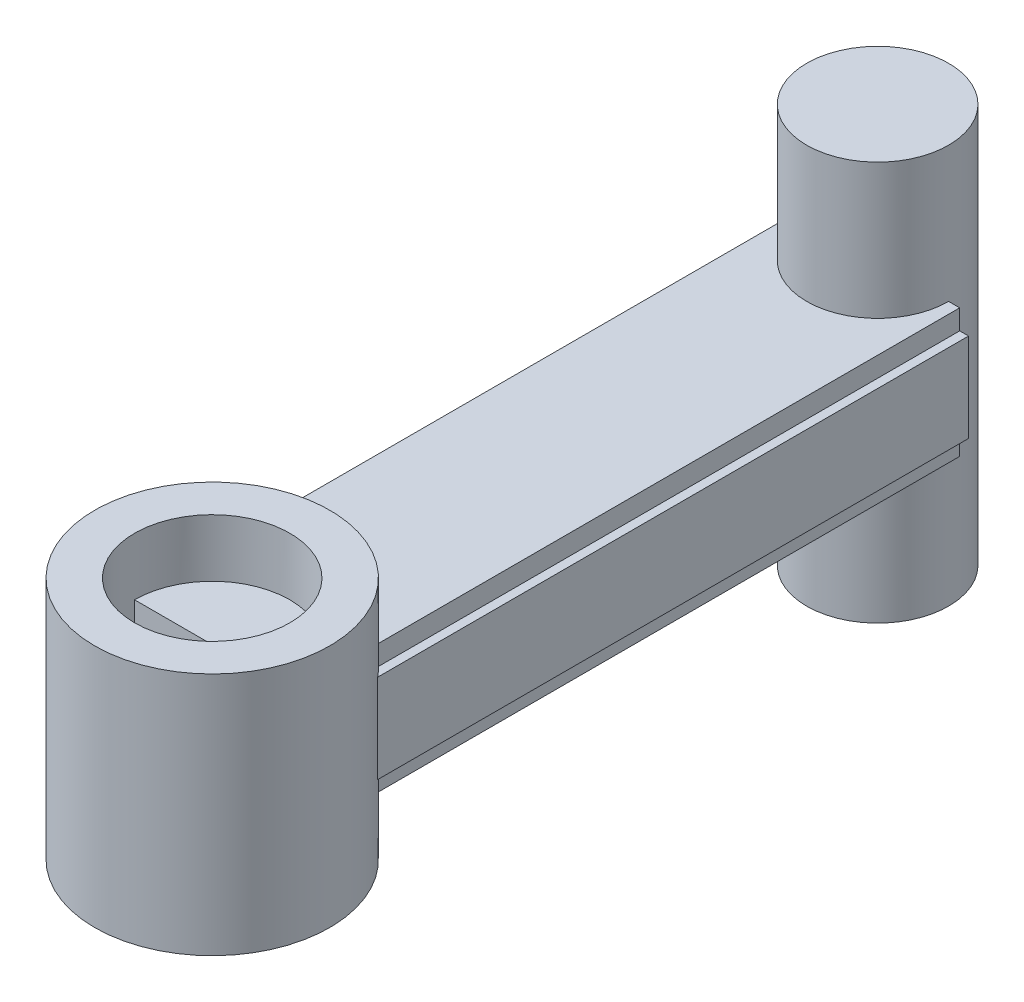
from build123d import *

# Parameters (mm, degrees)
EXTRUDE_1_DEPTH      = 90
EXTRUDE_1_DEPTH_BACK = 90
SKETCH_1_R           = 32
SKETCH_2_W           = 74
SKETCH_2_H           = 58
EXTRUDE_2_DEPTH      = 300
SKETCH_3_W           = 4
SKETCH_3_H           = 40
EXTRUDE_3_DEPTH      = 300
EXTRUDE_4_DEPTH      = 55
EXTRUDE_4_DEPTH_BACK = 55
SKETCH_4_R           = 53
SKETCH_4_R_2         = 35


with BuildPart() as part:
    # 草图1 → 凸台-拉伸1 (new, two sides: drawn at the far end of the back side and taken through both)
    with BuildSketch(Plane(origin=(0, 0, 0), x_dir=(1, 0, 0), z_dir=(0, 1, 0)).offset(-EXTRUDE_1_DEPTH_BACK)):
        Circle(SKETCH_1_R)
    extrude(amount=EXTRUDE_1_DEPTH + EXTRUDE_1_DEPTH_BACK)

    # 草图2 → 凸台-拉伸2 (add)
    with BuildSketch(Plane.XY):
        Rectangle(SKETCH_2_W, SKETCH_2_H)
    extrude(amount=EXTRUDE_2_DEPTH)

    # 草图3 → 凸台-拉伸3 (add)
    with BuildSketch(Plane.XY):
        with Locations((39, 0)):
            Rectangle(SKETCH_3_W, SKETCH_3_H)
        with Locations((-39, 0)):
            Rectangle(SKETCH_3_W, SKETCH_3_H)
    extrude(amount=EXTRUDE_3_DEPTH)

    # 草图4 → 凸台-拉伸4 (add, two sides: drawn at the far end of the back side and taken through both)
    with BuildSketch(Plane(origin=(0, 0, 0), x_dir=(1, 0, 0), z_dir=(0, 1, 0)).offset(-EXTRUDE_4_DEPTH_BACK)):
        with Locations((0, -300)):
            Circle(SKETCH_4_R)
        with Locations((0, -300)):
            Circle(SKETCH_4_R_2, mode=Mode.SUBTRACT)
    extrude(amount=EXTRUDE_4_DEPTH + EXTRUDE_4_DEPTH_BACK)


solid = part.part
